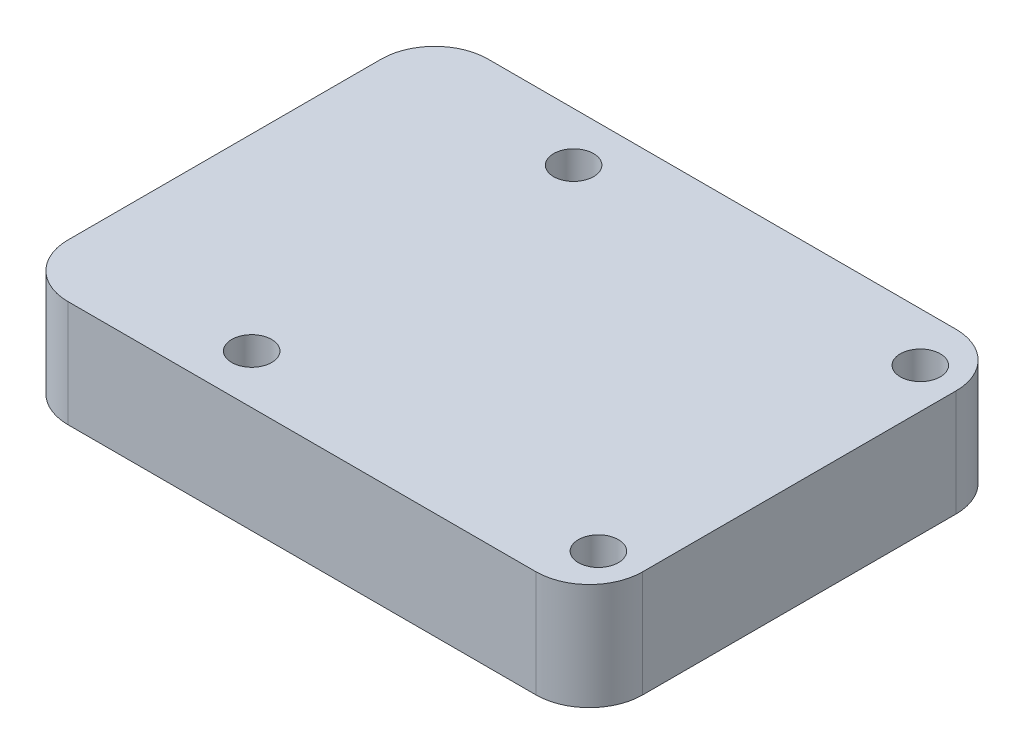
from build123d import *

# Parameters (mm, degrees)
SKETCH_1_W      = 43.1
SKETCH_1_H      = 31.5
SKETCH_1_R      = 1.5
EXTRUDE_1_DEPTH = 8
FILLET_1_R      = 4


with BuildPart() as part:
    # 草图1 → 凸台-拉伸1 (new body)
    with BuildSketch(Plane(origin=(0, 0, 0), x_dir=(1, 0, 0), z_dir=(0, 1, 0))):
        with Locations((-5.55, 0)):
            Rectangle(SKETCH_1_W, SKETCH_1_H)
        with Locations(Location((-13, 12.07, 0), (0, 0, 270))):
            Circle(SKETCH_1_R, mode=Mode.SUBTRACT)
        with Locations(Location((13, 12.07, 0), (0, 0, 270))):
            Circle(SKETCH_1_R, mode=Mode.SUBTRACT)
        with Locations(Location((13, -12.07, 0), (0, 0, 270))):
            Circle(SKETCH_1_R, mode=Mode.SUBTRACT)
        with Locations(Location((-13, -12.07, 0), (0, 0, 270))):
            Circle(SKETCH_1_R, mode=Mode.SUBTRACT)
    extrude(amount=EXTRUDE_1_DEPTH)

    # 圆角1
    fillet_1_edges = [part.edges().sort_by_distance(p)[0] for p in [
        (-27.1, 4, -15.75),
        (16, 4, -15.75),
        (16, 4, 15.75),
        (-27.1, 4, 15.75),
    ]]
    fillet(fillet_1_edges, radius=FILLET_1_R)


solid = part.part
